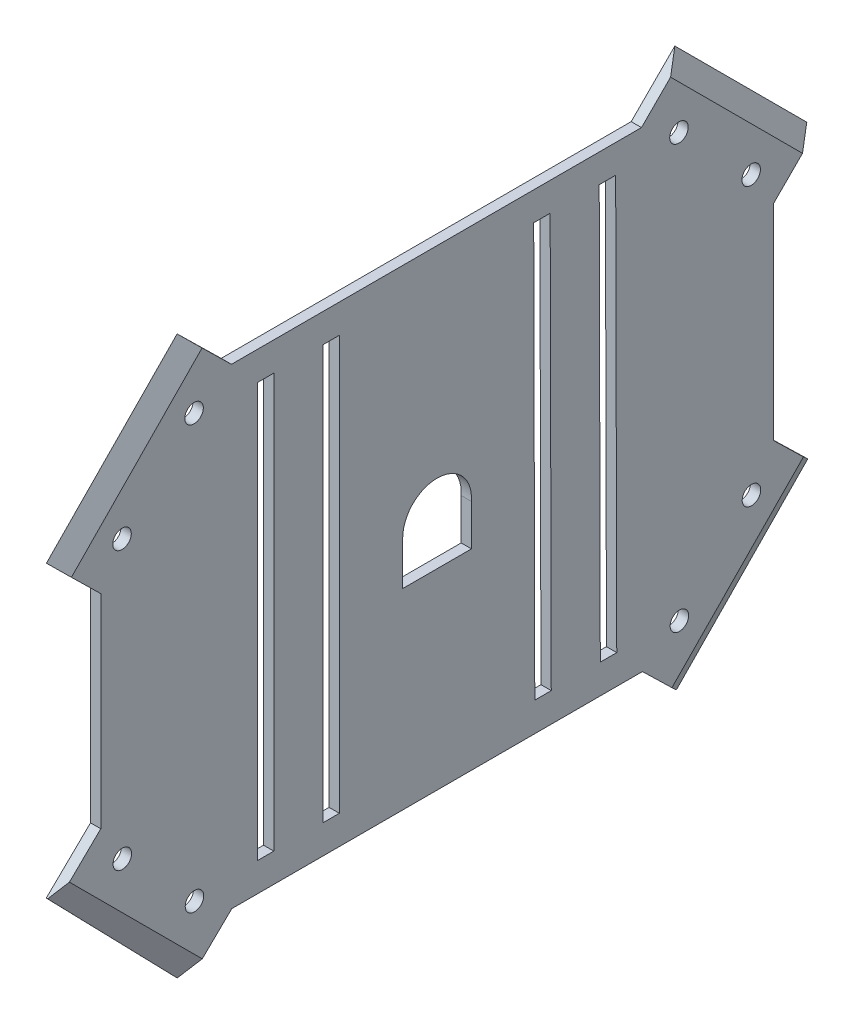
from build123d import *

# Parameters (mm, degrees)
SALIENTE_EXTRUIR1_DEPTH = 2.5
SALIENTE_EXTRUIR2_DEPTH = 2.5
CROQUIS3_R              = 2.25
CROQUIS3_W              = 4
CROQUIS3_H              = 100.57
CORTAR_EXTRUIR1_DEPTH   = 10
CORTAR_EXTRUIR3_DEPTH   = 82
CORTAR_EXTRUIR4_DEPTH   = 90


with BuildPart() as part:
    # Croquis1 → Saliente-Extruir1 (new body)
    with BuildSketch(Plane(origin=(0, 0, 0), x_dir=(0, 0, -1), z_dir=(1, 0, 0))):
        Polygon((-49.88, -57.285), (49.88, -57.285), (81.7, -24.565), (81.7, 25.235), (49.65, 57.285), (-49.95, 57.285), (-81.7, 24.905), (-81.7, -24.565), align=None)
    extrude(amount=SALIENTE_EXTRUIR1_DEPTH)

    # Croquis2 → Saliente-Extruir2 (add)
    with BuildSketch(Plane(origin=(2.5, 0, 0), x_dir=(0, 0, -1), z_dir=(1, 0, 0))):
        Polygon((81.7, 25.235), (49.65, 57.285), (60.256601718, 67.891601718), (92.306601718, 35.841601718), align=None)
        Polygon((-81.7, 24.905), (-49.95, 57.285), (-60.660282007, 67.786897892), (-92.410282007, 35.406897892), align=None)
        Polygon((-81.7, -24.565), (-49.88, -57.285), (-60.633463585, -67.742677606), (-92.453463585, -35.022677606), align=None)
        Polygon((49.88, -57.285), (81.7, -24.565), (92.453463585, -35.022677606), (60.633463585, -67.742677606), align=None)
    extrude(amount=-SALIENTE_EXTRUIR2_DEPTH)

    # Croquis3 → Cortar-Extruir1 (cut)
    with BuildSketch(Plane(origin=(2.5, 0, 0), x_dir=(0, 0, -1), z_dir=(1, 0, 0))):
        with Locations((-76.540373615, 33.850995118)):
            Circle(CROQUIS3_R)
        with Locations((-59.042204467, 51.550828198)):
            Circle(CROQUIS3_R)
        with Locations((76.301473252, 34.051102275)):
            Circle(CROQUIS3_R)
        with Locations((58.757017396, 51.705056035)):
            Circle(CROQUIS3_R)
        with Locations((76.369576687, -33.391936282)):
            Circle(CROQUIS3_R)
        with Locations((58.860810215, -51.081286502)):
            Circle(CROQUIS3_R)
        with Locations((-58.938482889, -51.164964143)):
            Circle(CROQUIS3_R)
        with Locations((-76.472362613, -33.500506143)):
            Circle(CROQUIS3_R)
        with BuildLine():
            Line((-8.35, 0), (-8.35, -10.698407243))
            Line((-8.35, -10.698407243), (8.347094832, -10.698407243))
            Line((8.347094832, -10.698407243), (8.321717757, -0.686668462))
            ThreePointArc((8.321717757, -0.686668462), (0.343625327, 8.342926443), (-8.35, 0))
        make_face()
        Polygon((23.469483411, 50.346823407), (23.732824148, -50.222831816), (27.732810435, -50.212357888), (27.469469698, 50.357297335), align=None)
        with Locations((-41.664502762, 0)):
            Rectangle(CROQUIS3_W, CROQUIS3_H)
        with Locations((-25.751234947, 0)):
            Rectangle(CROQUIS3_W, CROQUIS3_H)
        Polygon((39.382696671, 50.388492013), (39.646037409, -50.18116321), (43.646023696, -50.170689282), (43.382682959, 50.398965941), align=None)
    extrude(amount=-CORTAR_EXTRUIR1_DEPTH, mode=Mode.SUBTRACT)

    # Croquis4 → Cortar-Extruir3 (cut)
    with BuildSketch(Plane(origin=(0, -28.144978127, 27.597376638), x_dir=(1, 0, 0), z_dir=(0, -0.7140188004824893, 0.7001265261062083))):
        Polygon((0, 90.771987132), (2.5, 90.771987132), (2.5, 85.771987132), align=None)
        Polygon((2.5, -90.72187848), (0, -90.72187848), (2.5, -85.72187848), align=None)
    extrude(amount=-CORTAR_EXTRUIR3_DEPTH, mode=Mode.SUBTRACT)

    # Croquis6 → Cortar-Extruir4 (cut)
    with BuildSketch(Plane(origin=(0, -28.2325, -28.2325), x_dir=(1, 0, 0), z_dir=(0, -0.7071067811865475, -0.7071067811865477))):
        Polygon((0, -90.614463646), (2.5, -85.614463646), (2.5, -90.614463646), align=None)
        Polygon((0, 90.775639979), (2.5, 90.775639979), (2.5, 85.775639979), align=None)
    extrude(amount=-CORTAR_EXTRUIR4_DEPTH, mode=Mode.SUBTRACT)


solid = part.part
